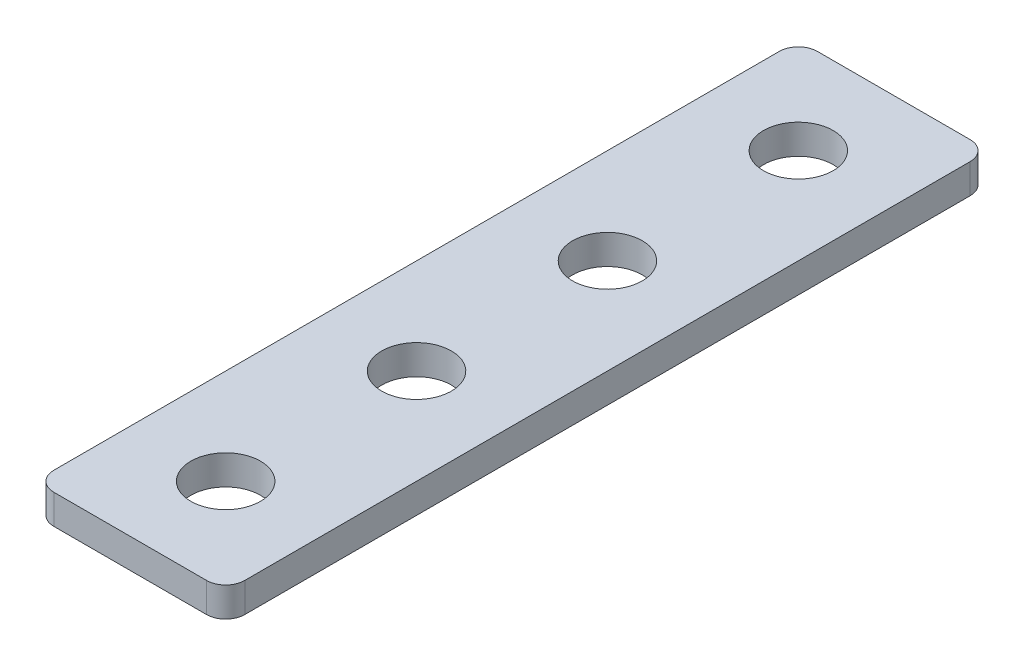
from build123d import *

# Parameters (mm, degrees)
SKETCH1_W           = 10
SKETCH1_H           = 40
SKETCH1_R           = 1.825
BOSS_EXTRUDE1_DEPTH = 1.55
FILLET1_R           = 1


with BuildPart() as part:
    # Sketch1 → Boss-Extrude1 (new body)
    with BuildSketch(Plane(origin=(0, 0, 0), x_dir=(1, 0, 0), z_dir=(0, 1, 0))):
        Rectangle(SKETCH1_W, SKETCH1_H)
        with Locations(Location((0, 15, 0), (0, 0, 90))):
            Circle(SKETCH1_R, mode=Mode.SUBTRACT)
        with Locations(Location((0, 5, 0), (0, 0, 90))):
            Circle(SKETCH1_R, mode=Mode.SUBTRACT)
        with Locations(Location((0, -5, 0), (0, 0, 90))):
            Circle(SKETCH1_R, mode=Mode.SUBTRACT)
        with Locations(Location((0, -15, 0), (0, 0, 90))):
            Circle(SKETCH1_R, mode=Mode.SUBTRACT)
    extrude(amount=BOSS_EXTRUDE1_DEPTH)

    # Fillet1
    fillet1_edges = [part.edges().sort_by_distance(p)[0] for p in [
        (5, 0.775, 20),
        (-5, 0.775, 20),
        (-5, 0.775, -20),
        (5, 0.775, -20),
    ]]
    fillet(fillet1_edges, radius=FILLET1_R)


solid = part.part
